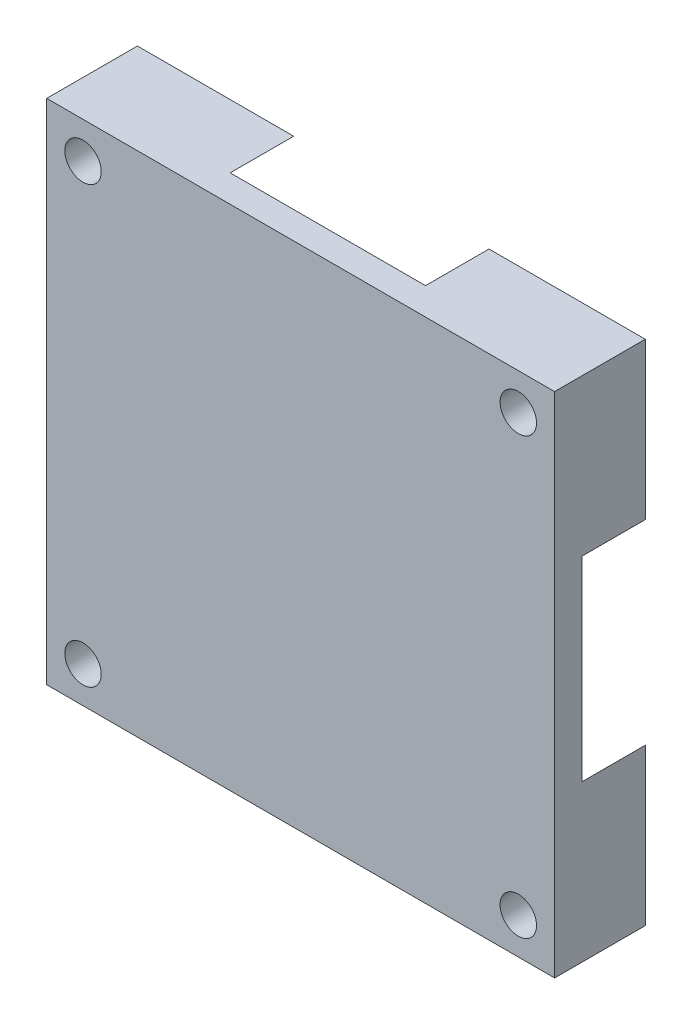
from build123d import *

# Parameters (mm, degrees)
SKETCH1_W                      = 71.12
SKETCH1_H                      = 71.12
BOSS_EXTRUDE1_DEPTH            = 12.7
SKETCH2_R                      = 38.1
CUT_EXTRUDE1_DEPTH             = 8.89
F_7_0_201_DIAMETER_HOLE1_D     = 5.1054
F_7_0_201_DIAMETER_HOLE1_DEPTH = 31.75
F_7_0_201_DIAMETER_HOLE1_TIP   = 1.533816902


with BuildPart() as part:
    # Sketch1 → Boss-Extrude1 (new body)
    with BuildSketch(Plane.XY):
        Rectangle(SKETCH1_W, SKETCH1_H)
    extrude(amount=BOSS_EXTRUDE1_DEPTH)

    # Sketch2 → Cut-Extrude1 (cut)
    with BuildSketch(Plane(origin=(0, 0, 0), x_dir=(-1, 0, 0), z_dir=(0, 0, -1))):
        Circle(SKETCH2_R)
    extrude(amount=-CUT_EXTRUDE1_DEPTH, mode=Mode.SUBTRACT)

    # #7 (0.201) Diameter Hole1
    with Locations(Plane.XY.offset(12.7)):
        with Locations((30.48, 30.48), (-30.48, 30.48), (-30.48, -30.48), (30.48, -30.48)):
            Hole(F_7_0_201_DIAMETER_HOLE1_D / 2, depth=F_7_0_201_DIAMETER_HOLE1_DEPTH)
            with Locations((0, 0, -(F_7_0_201_DIAMETER_HOLE1_DEPTH + F_7_0_201_DIAMETER_HOLE1_TIP / 2))):  # 118° drill point
                Cone(0, F_7_0_201_DIAMETER_HOLE1_D / 2, F_7_0_201_DIAMETER_HOLE1_TIP, mode=Mode.SUBTRACT)


solid = part.part
